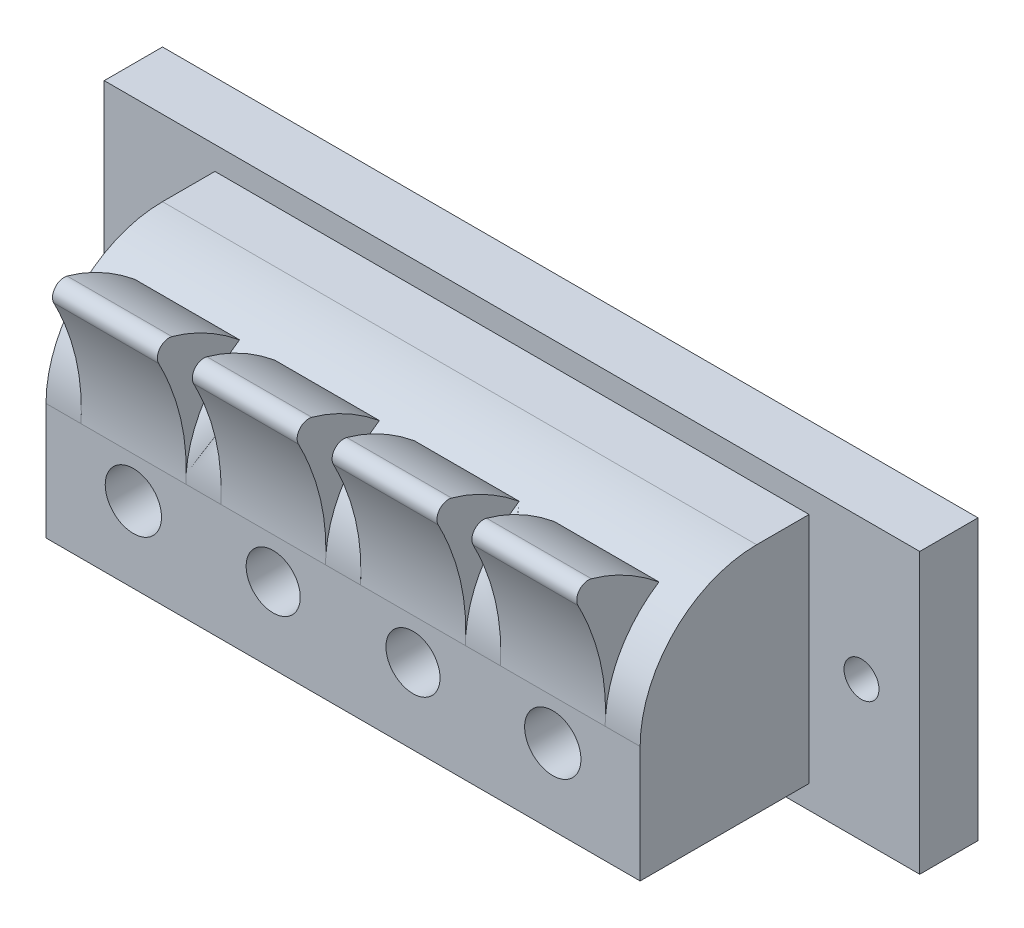
from build123d import *

# Parameters (mm, degrees)
SKETCH1_W                = 70
SKETCH1_H                = 24
SKETCH1_R                = 1.5
BOSS_EXTRUDE1_DEPTH      = 5
BOSS_EXTRUDE2_DEPTH      = 25.5
BOSS_EXTRUDE2_DEPTH_BACK = 25.5
SKETCH3_R                = 2.321982534
SKETCH3_R_2              = 2.416824645
SKETCH3_W                = 9
SKETCH3_H                = 8
CUT_EXTRUDE1_DEPTH       = 10
BOSS_EXTRUDE3_DEPTH      = 9
BOSS_EXTRUDE4_DEPTH      = 9
BOSS_EXTRUDE5_DEPTH      = 9
BOSS_EXTRUDE6_DEPTH      = 9


with BuildPart() as part:
    # Sketch1 → Boss-Extrude1 (new body)
    with BuildSketch(Plane.XY):
        Rectangle(SKETCH1_W, SKETCH1_H)
        with Locations((-30, 0)):
            Circle(SKETCH1_R, mode=Mode.SUBTRACT)
        with Locations((30, 0)):
            Circle(SKETCH1_R, mode=Mode.SUBTRACT)
    extrude(amount=BOSS_EXTRUDE1_DEPTH)

    # Sketch2 → Boss-Extrude2 (add, two sides: drawn at the far end of the back side and taken through both)
    with BuildSketch(Plane(origin=(0, 0, 0), x_dir=(0, 0, -1), z_dir=(1, 0, 0)).offset(-BOSS_EXTRUDE2_DEPTH_BACK)):
        with BuildLine():
            Line((-5, -10), (-19.5, -10))
            Line((-19.5, -10), (-19.5, 0))
            ThreePointArc((-19.5, 0), (-16.571067812, 7.071067812), (-9.5, 10))
            Line((-9.5, 10), (-5, 10))
            Line((-5, 10), (-5, -10))
        make_face()
    extrude(amount=BOSS_EXTRUDE2_DEPTH + BOSS_EXTRUDE2_DEPTH_BACK)

    # Sketch3 → Cut-Extrude1 (cut)
    with BuildSketch(Plane.XY.offset(19.5)):
        with Locations((6, -3.5)):
            Circle(SKETCH3_R)
        with Locations((18, -3.5)):
            Circle(SKETCH3_R_2)
        with Locations((-18, -3.5)):
            Circle(SKETCH3_R_2)
        with Locations((-6, -3.5)):
            Circle(SKETCH3_R)
        with Locations((6, 4)):
            Rectangle(SKETCH3_W, SKETCH3_H)
        with Locations((18, 4)):
            Rectangle(SKETCH3_W, SKETCH3_H)
        with Locations((-18, 4)):
            Rectangle(SKETCH3_W, SKETCH3_H)
        with Locations((-6, 4)):
            Rectangle(SKETCH3_W, SKETCH3_H)
    extrude(amount=-CUT_EXTRUDE1_DEPTH, mode=Mode.SUBTRACT)

    # Sketch4 → Boss-Extrude3 (add)
    with BuildSketch(Plane.ZY.offset(22.5)):
        with BuildLine():
            Line((9.015316461, 0), (19.5, 0))
            add(Edge.make_bspline(
                [(19.5, 0), (19.395916198, 1.673959857), (19.680366362, 5.037515591), (20.950052063, 8.432343367), (21.831203798, 10.137575266)],
                knots=[0, 0, 0, 0, 0.423484127, 0.846968255, 0.846968255, 0.846968255, 0.846968255], degree=3))
            ThreePointArc((21.831203798, 10.137575266), (21.720999609, 11.224662671), (20.681702642, 11.56195454))
            add(Edge.make_bspline(
                [(20.681702642, 11.56195454), (15.653773695, 10.201988893), (10.35157066, 5.000520578), (9.015316461, 0)],
                knots=[0.123886132, 0.123886132, 0.123886132, 0.123886132, 1, 1, 1, 1], degree=3))
        make_face()
    extrude(amount=-BOSS_EXTRUDE3_DEPTH)

    # Sketch6 → Boss-Extrude4 (add)
    with BuildSketch(Plane(origin=(-10.5, 0, 0), x_dir=(0, 0, -1), z_dir=(1, 0, 0))):
        with BuildLine():
            Line((-9.015316461, 0), (-19.5, 0))
            add(Edge.make_bspline(
                [(-19.5, 0), (-19.395916198, 1.673959857), (-19.680366362, 5.037515591), (-20.950052063, 8.432343367), (-21.831203798, 10.137575266)],
                knots=[0, 0, 0, 0, 0.423484127, 0.846968255, 0.846968255, 0.846968255, 0.846968255], degree=3))
            ThreePointArc((-21.831203798, 10.137575266), (-21.720999609, 11.224662671), (-20.681702642, 11.56195454))
            add(Edge.make_bspline(
                [(-20.681702642, 11.56195454), (-15.653773695, 10.201988893), (-10.35157066, 5.000520578), (-9.015316461, 0)],
                knots=[0.123886132, 0.123886132, 0.123886132, 0.123886132, 1, 1, 1, 1], degree=3))
        make_face()
    extrude(amount=BOSS_EXTRUDE4_DEPTH)

    # Sketch7 → Boss-Extrude5 (add)
    with BuildSketch(Plane(origin=(1.5, 0, 0), x_dir=(0, 0, -1), z_dir=(1, 0, 0))):
        with BuildLine():
            Line((-9.015316461, 0), (-19.5, 0))
            add(Edge.make_bspline(
                [(-19.5, 0), (-19.395916198, 1.673959857), (-19.680366362, 5.037515591), (-20.950052063, 8.432343367), (-21.831203798, 10.137575266)],
                knots=[0, 0, 0, 0, 0.423484127, 0.846968255, 0.846968255, 0.846968255, 0.846968255], degree=3))
            ThreePointArc((-21.831203798, 10.137575266), (-21.720999609, 11.224662671), (-20.681702642, 11.56195454))
            add(Edge.make_bspline(
                [(-20.681702642, 11.56195454), (-15.653773695, 10.201988893), (-10.35157066, 5.000520578), (-9.015316461, 0)],
                knots=[0.123886132, 0.123886132, 0.123886132, 0.123886132, 1, 1, 1, 1], degree=3))
        make_face()
    extrude(amount=BOSS_EXTRUDE5_DEPTH)

    # Sketch8 → Boss-Extrude6 (add)
    with BuildSketch(Plane(origin=(13.5, 0, 0), x_dir=(0, 0, -1), z_dir=(1, 0, 0))):
        with BuildLine():
            Line((-9.015316461, 0), (-19.5, 0))
            add(Edge.make_bspline(
                [(-19.5, 0), (-19.395916198, 1.673959857), (-19.680366362, 5.037515591), (-20.950052063, 8.432343367), (-21.831203798, 10.137575266)],
                knots=[0, 0, 0, 0, 0.423484127, 0.846968255, 0.846968255, 0.846968255, 0.846968255], degree=3))
            ThreePointArc((-21.831203798, 10.137575266), (-21.720999609, 11.224662671), (-20.681702642, 11.56195454))
            add(Edge.make_bspline(
                [(-20.681702642, 11.56195454), (-15.653773695, 10.201988893), (-10.35157066, 5.000520578), (-9.015316461, 0)],
                knots=[0.123886132, 0.123886132, 0.123886132, 0.123886132, 1, 1, 1, 1], degree=3))
        make_face()
    extrude(amount=BOSS_EXTRUDE6_DEPTH)


solid = part.part
